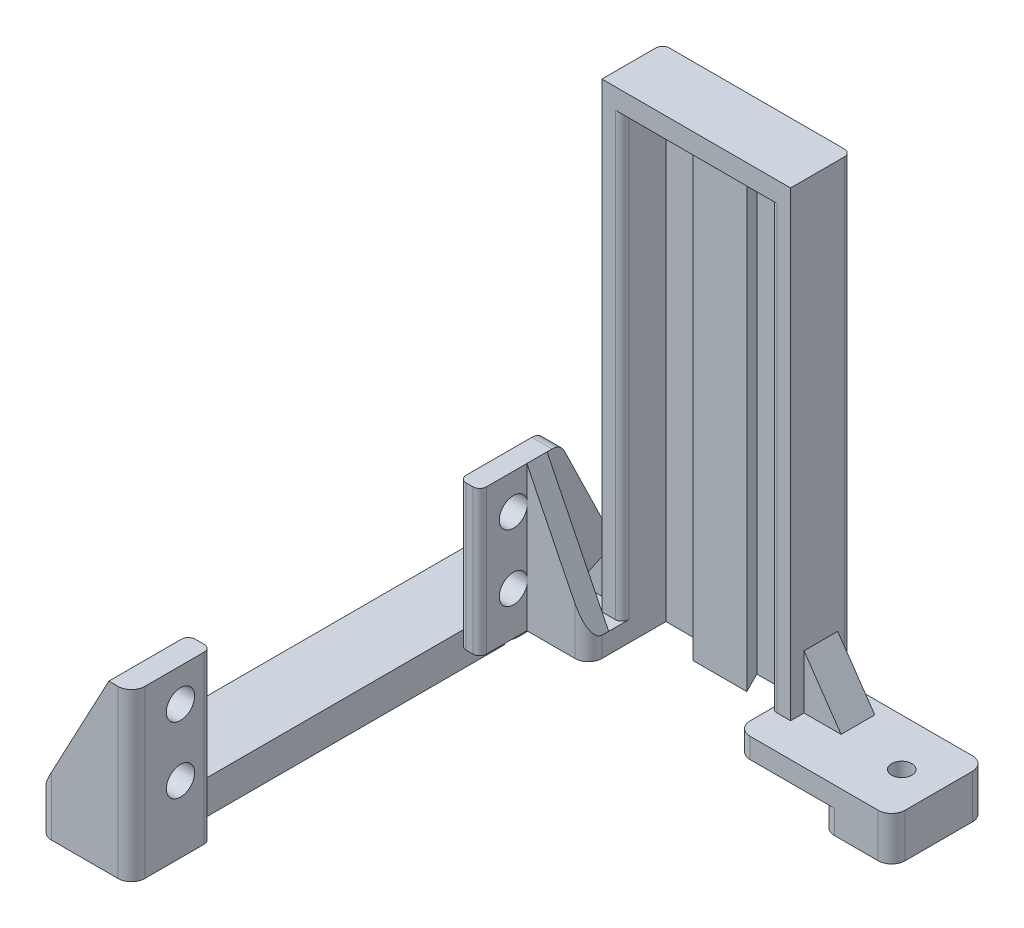
from build123d import *

# Parameters (mm, degrees)
SKETCH_1_W          = 28
SKETCH_1_H          = 14
SKETCH_1_W_2        = 22
SKETCH_1_H_2        = 8
EXTRUDE_1_DEPTH     = 75
SKETCH_2_W          = 22
SKETCH_2_H          = 8
EXTRUDE_2_DEPTH     = 3
SKETCH_3_W          = 22
SKETCH_3_H          = 11
CUT_EXTRUDE_1_DEPTH = 72
SKETCH_4_W          = 20
SKETCH_4_H          = 14
EXTRUDE_3_DEPTH     = 6.5
SKETCH_5_R          = 1.5
CUT_EXTRUDE_2_DEPTH = 83.643814046
FILLET_1_R          = 2
EXTRUDE_5_REACH     = 84.644
SKETCH_9_W          = 28
SKETCH_9_H          = 5
CUT_EXTRUDE_3_DEPTH = 68.5
FILLET_3_R          = 1
EXTRUDE_6_DEPTH     = 2.5
SKETCH_11_W         = 12
SKETCH_11_H         = 25
SKETCH_11_R         = 2.1
EXTRUDE_7_DEPTH     = 3
EXTRUDE_9_DEPTH     = 3
EXTRUDE_8_DEPTH     = 3
SKETCH_16_W         = 47
SKETCH_16_H         = 24
CUT_EXTRUDE_4_DEPTH = 3.5
FILLET_12_R         = 2
FILLET_14_R         = 2
SKETCH_17_W         = 10.5
SKETCH_17_H         = 5
EXTRUDE_10_DEPTH    = 58.7
SKETCH_18_W         = 11.8
SKETCH_18_H         = 24.7
EXTRUDE_11_DEPTH    = 3.35
CUT_EXTRUDE_5_REACH = 115.462
SKETCH_19_R         = 2.1
CUT_EXTRUDE_6_REACH = 103.845
SKETCH_20_R         = 1.6
CUT_EXTRUDE_7_REACH = 103.127
SKETCH_21_W         = 10.85
SKETCH_21_H         = 1.5
EXTRUDE_12_DEPTH    = 2
FILLET_15_R         = 2
FILLET_16_R         = 1
CUT_EXTRUDE_8_DEPTH = 68.5


with BuildPart() as part:
    # 草图1 → 凸台-拉伸1 (new body)
    with BuildSketch(Plane(origin=(0, 0, 0), x_dir=(1, 0, 0), z_dir=(0, 1, 0))):
        Rectangle(SKETCH_1_W, SKETCH_1_H)
        Rectangle(SKETCH_1_W_2, SKETCH_1_H_2, mode=Mode.SUBTRACT)
    extrude(amount=EXTRUDE_1_DEPTH)

    # 草图2 → 凸台-拉伸2 (add)
    with BuildSketch(Plane(origin=(0, 75, 0), x_dir=(1, 0, 0), z_dir=(0, 1, 0))):
        Rectangle(SKETCH_2_W, SKETCH_2_H)
    extrude(amount=-EXTRUDE_2_DEPTH)

    # 草图3 → 切除-拉伸1 (cut)
    with BuildSketch(Plane.XZ):
        with Locations((0, 1.5)):
            Rectangle(SKETCH_3_W, SKETCH_3_H)
    extrude(amount=-CUT_EXTRUDE_1_DEPTH, mode=Mode.SUBTRACT)

    # 草图4 → 凸台-拉伸3 (add)
    with BuildSketch(Plane.XZ):
        with Locations((-24, 0)):
            Rectangle(SKETCH_4_W, SKETCH_4_H)
        with Locations((24, 0)):
            Rectangle(SKETCH_4_W, SKETCH_4_H)
    extrude(amount=-EXTRUDE_3_DEPTH)

    # 草图5 → 切除-拉伸2 (cut, through all)
    with BuildSketch(Plane.XZ):
        with Locations(Location((-28.5, 0, 0), (0, 0, 270))):
            Circle(SKETCH_5_R)
        with Locations(Location((28.5, 0, 0), (0, 0, 270))):
            Circle(SKETCH_5_R)
    extrude(amount=-CUT_EXTRUDE_2_DEPTH, mode=Mode.SUBTRACT)

    # 圆角1
    fillet_1_edges = [part.edges().sort_by_distance(p)[0] for p in [
        (-34, 3.25, -7),
        (34, 3.25, 7),
        (34, 3.25, -7),
    ]]
    fillet(fillet_1_edges, radius=FILLET_1_R)

    # 草图7 → 凸台-拉伸5 (add, up to next)
    with BuildSketch(Plane.XZ, mode=Mode.PRIVATE) as extrude_5_sk1:
        Polygon((-2.5, -4.5), (2.5, -4.5), (4, -1.5), (-4, -1.5), align=None)
    extrude_5_tool1 = extrude(extrude_5_sk1.sketch, amount=-EXTRUDE_5_REACH, mode=Mode.PRIVATE) - part.part
    add(extrude_5_tool1.solids().sort_by_distance((0, 0, -2.884615))[0])

    # 草图9 → 切除-拉伸3 (cut)
    with BuildSketch(Plane(origin=(0, 75, 0), x_dir=(1, 0, 0), z_dir=(0, 1, 0))):
        with Locations((0, -4.5)):
            Rectangle(SKETCH_9_W, SKETCH_9_H)
    extrude(amount=-CUT_EXTRUDE_3_DEPTH, mode=Mode.SUBTRACT)

    # 圆角3
    fillet_3_edges = [part.edges().sort_by_distance(p)[0] for p in [
        (11, 39.25, 2),
        (-11, 39.25, 2),
        (-14, 40.75, -7),
        (14, 40.75, -7),
    ]]
    fillet(fillet_3_edges, radius=FILLET_3_R)

    # 草图10 → 凸台-拉伸6 (add, symmetric)
    with BuildSketch(Plane(origin=(0, 0, -2.5), x_dir=(-1, 0, 0), z_dir=(0, 0, -1))):
        Polygon((-14, 6.5), (-19.5, 6.5), (-14, 14.5), align=None)
    extrude_6 = extrude(amount=EXTRUDE_6_DEPTH, both=True)

    # 镜向2: 凸台-拉伸6 across plane
    add(extrude_6.mirror(Plane(origin=(0, 0, 0), x_dir=(0, 0, 1), z_dir=(1, 0, 0))))

    # 草图11 → 凸台-拉伸7 (add)
    with BuildSketch(Plane.ZY.offset(20.15)):
        with Locations((8, 12.5)):
            Rectangle(SKETCH_11_W, SKETCH_11_H)
        with Locations((8.988854382, 19.775)):
            Circle(SKETCH_11_R, mode=Mode.SUBTRACT)
        with Locations((8.988854382, 9.925)):
            Circle(SKETCH_11_R, mode=Mode.SUBTRACT)
    extrude(amount=EXTRUDE_7_DEPTH)

    # 草图14 → 凸台-拉伸9 (add)
    with BuildSketch(Plane.ZY.offset(23.15)):
        Polygon((2, 25), (-7, 6.5), (2, 6.5), align=None)
    extrude(amount=-EXTRUDE_9_DEPTH)

    # 草图12 → 凸台-拉伸8 (add)
    with BuildSketch(Plane.XY.offset(7)):
        Polygon((-20.15, 6.5), (-20.15, 25), (-11, 6.5), align=None)
    extrude(amount=-EXTRUDE_8_DEPTH)

    # 草图16 → 切除-拉伸4 (cut)
    with BuildSketch(Plane.XZ):
        with Locations((0, 5)):
            Rectangle(SKETCH_16_W, SKETCH_16_H)
    extrude(amount=-CUT_EXTRUDE_4_DEPTH, mode=Mode.SUBTRACT)

    # 圆角12
    fillet_12_edges = [part.edges().sort_by_distance(p)[0] for p in [
        (-11, 5, 7),
        (11, 5, 7),
        (-23.5, 1.75, 7),
        (-23.5, 1.75, -7),
        (23.5, 1.75, 7),
        (23.5, 1.75, -7),
    ]]
    fillet(fillet_12_edges, radius=FILLET_12_R)

    # 圆角14
    fillet_14_edges = [part.edges().sort_by_distance(p)[0] for p in [
        (-21.65, 25, 2),
    ]]
    fillet(fillet_14_edges, radius=FILLET_14_R)

    # 草图17 → 凸台-拉伸10 (add)
    with BuildSketch(Plane.XY.offset(7)):
        with Locations((-28.75, 2.5)):
            Rectangle(SKETCH_17_W, SKETCH_17_H)
    extrude(amount=EXTRUDE_10_DEPTH)

    # 草图18 → 凸台-拉伸11 (add)
    with BuildSketch(Plane(origin=(-23.5, 0, 0), x_dir=(0, 0, -1), z_dir=(1, 0, 0))):
        with Locations((-59.8, 12.35)):
            Rectangle(SKETCH_18_W, SKETCH_18_H)
    extrude(amount=EXTRUDE_11_DEPTH)

    # 草图19 → 切除-拉伸5 (cut, up to next)
    with BuildSketch(Plane(origin=(-20.15, 0, 0), x_dir=(0, 0, -1), z_dir=(1, 0, 0)), mode=Mode.PRIVATE) as cut_extrude_5_sk1:
        with Locations(Location((-58.411145618, 9.925, 0), (0, 0, 90))):
            Circle(SKETCH_19_R)
    cut_extrude_5_tool1 = extrude(cut_extrude_5_sk1.sketch, amount=-CUT_EXTRUDE_5_REACH, mode=Mode.PRIVATE) & part.part
    # 草图19 → 切除-拉伸5 (cut, up to next)
    with BuildSketch(Plane(origin=(-20.15, 0, 0), x_dir=(0, 0, -1), z_dir=(1, 0, 0)), mode=Mode.PRIVATE) as cut_extrude_5_sk2:
        with Locations(Location((-58.411145618, 19.775, 0), (0, 0, 90))):
            Circle(SKETCH_19_R)
    cut_extrude_5_tool2 = extrude(cut_extrude_5_sk2.sketch, amount=-CUT_EXTRUDE_5_REACH, mode=Mode.PRIVATE) & part.part
    add(cut_extrude_5_tool1.solids().sort_by_distance((-20.15, 9.925, 58.411146))[0], mode=Mode.SUBTRACT)
    add(cut_extrude_5_tool2.solids().sort_by_distance((-20.15, 19.775, 58.411146))[0], mode=Mode.SUBTRACT)

    # 草图20 → 切除-拉伸6 (cut, up to next)
    with BuildSketch(Plane(origin=(0, 5, 0), x_dir=(1, 0, 0), z_dir=(0, 1, 0)), mode=Mode.PRIVATE) as cut_extrude_6_sk1:
        with Locations(Location((-30, -59.7, 0), (0, 0, 270))):
            Circle(SKETCH_20_R)
    cut_extrude_6_tool1 = extrude(cut_extrude_6_sk1.sketch, amount=-CUT_EXTRUDE_6_REACH, mode=Mode.PRIVATE) & part.part
    add(cut_extrude_6_tool1.solids().sort_by_distance((-30, 5, 59.7))[0], mode=Mode.SUBTRACT)

    # 草图21 → 切除-拉伸7 (cut, up to next)
    with BuildSketch(Plane.XY.offset(7), mode=Mode.PRIVATE) as cut_extrude_7_sk1:
        with Locations((-28.575, 5.75)):
            Rectangle(SKETCH_21_W, SKETCH_21_H)
    cut_extrude_7_tool1 = extrude(cut_extrude_7_sk1.sketch, amount=-CUT_EXTRUDE_7_REACH, mode=Mode.PRIVATE) & part.part
    add(cut_extrude_7_tool1.solids().sort_by_distance((-28.575, 5.75, 7))[0], mode=Mode.SUBTRACT)

    # 草图22 → 凸台-拉伸12 (add)
    with BuildSketch(Plane.XY.offset(65.7)):
        Polygon((-23.5, 5), (-34, 5), (-23.5, 24.7), align=None)
    extrude(amount=-EXTRUDE_12_DEPTH)

    # 圆角15
    fillet_15_edges = [part.edges().sort_by_distance(p)[0] for p in [
        (-34, 2.5, 65.7),
        (-20.15, 12.35, 65.7),
    ]]
    fillet(fillet_15_edges, radius=FILLET_15_R)

    # 圆角16
    fillet_16_edges = [part.edges().sort_by_distance(p)[0] for p in [
        (-20.15, 14.25, 14),
        (-23.15, 14.25, 14),
        (-23.5, 14.85, 53.9),
        (-20.15, 12.35, 53.9),
    ]]
    fillet(fillet_16_edges, radius=FILLET_16_R)

    # 草图23 → 切除-拉伸8 (cut)
    with BuildSketch(Plane.XZ.offset(-3.5)):
        Polygon((-11, -4), (-11, -4.5), (-2.5, -4.5), (-2.75, -4), align=None)
        Polygon((11, -4), (11, -4.5), (2.5, -4.5), (2.75, -4), align=None)
    extrude(amount=-CUT_EXTRUDE_8_DEPTH, mode=Mode.SUBTRACT)


solid = part.part
